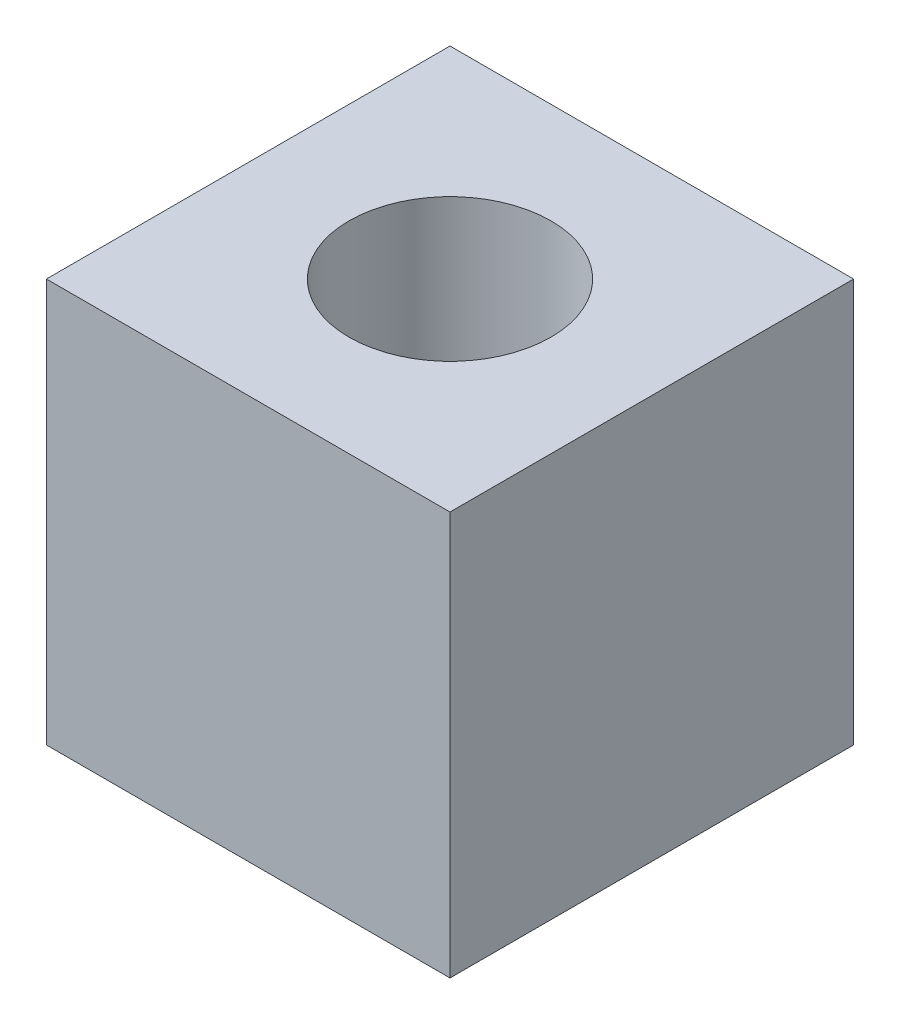
from build123d import *

# Parameters (mm, degrees)
SKETCH1_W           = 12.7
SKETCH1_H           = 12.7
BOSS_EXTRUDE1_DEPTH = 12.7
SKETCH2_R           = 3.175
CUT_EXTRUDE1_DEPTH  = 16.51


with BuildPart() as part:
    # Sketch1 → Boss-Extrude1 (new body)
    with BuildSketch(Plane(origin=(0, 0, 0), x_dir=(1, 0, 0), z_dir=(0, 1, 0))):
        Rectangle(SKETCH1_W, SKETCH1_H)
    extrude(amount=BOSS_EXTRUDE1_DEPTH)

    # Sketch2 → Cut-Extrude1 (cut)
    with BuildSketch(Plane(origin=(0, 0, 0), x_dir=(-1, 0, 0), z_dir=(0, -1, 0))):
        with Locations(Location((0, 0, 0), (0, 0, 90))):
            Circle(SKETCH2_R)
    extrude(amount=-CUT_EXTRUDE1_DEPTH, mode=Mode.SUBTRACT)


solid = part.part
